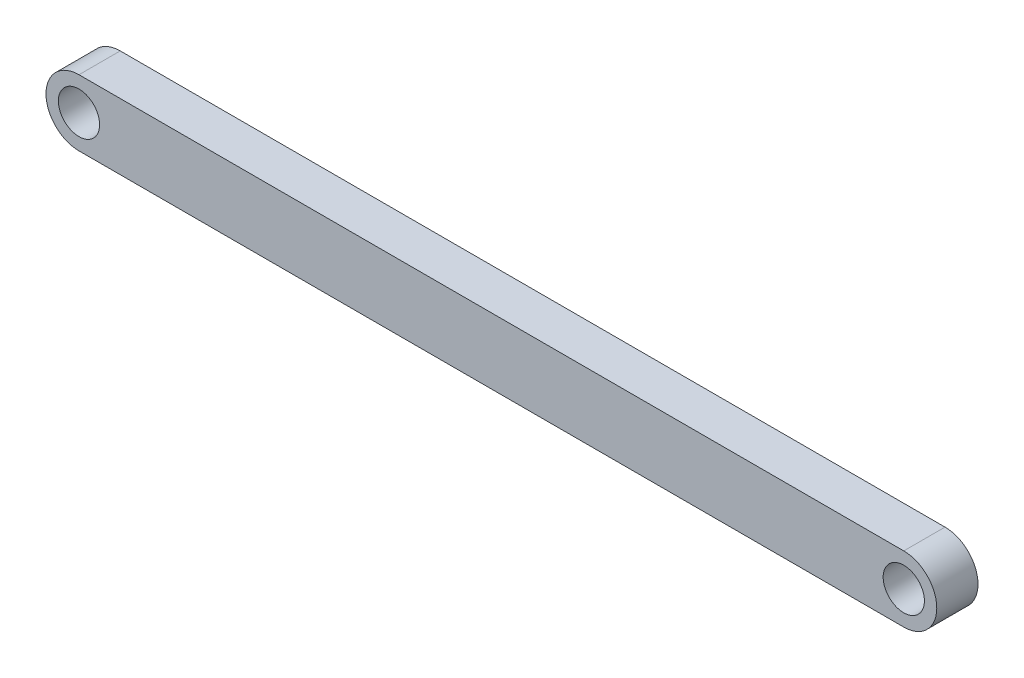
from build123d import *

# Parameters (mm, degrees)
SKETCH_1_R      = 2.5
EXTRUDE_1_DEPTH = 5


with BuildPart() as part:
    # 草图1 → 凸台-拉伸1 (new body)
    with BuildSketch(Plane.XY):
        with BuildLine():
            Line((100, -4), (0, -4))
            ThreePointArc((0, -4), (-4, 0), (0, 4))
            Line((0, 4), (100, 4))
            ThreePointArc((100, 4), (104, 0), (100, -4))
        make_face()
        Circle(SKETCH_1_R, mode=Mode.SUBTRACT)
        with Locations((100, 0)):
            Circle(SKETCH_1_R, mode=Mode.SUBTRACT)
    extrude(amount=EXTRUDE_1_DEPTH)


solid = part.part
